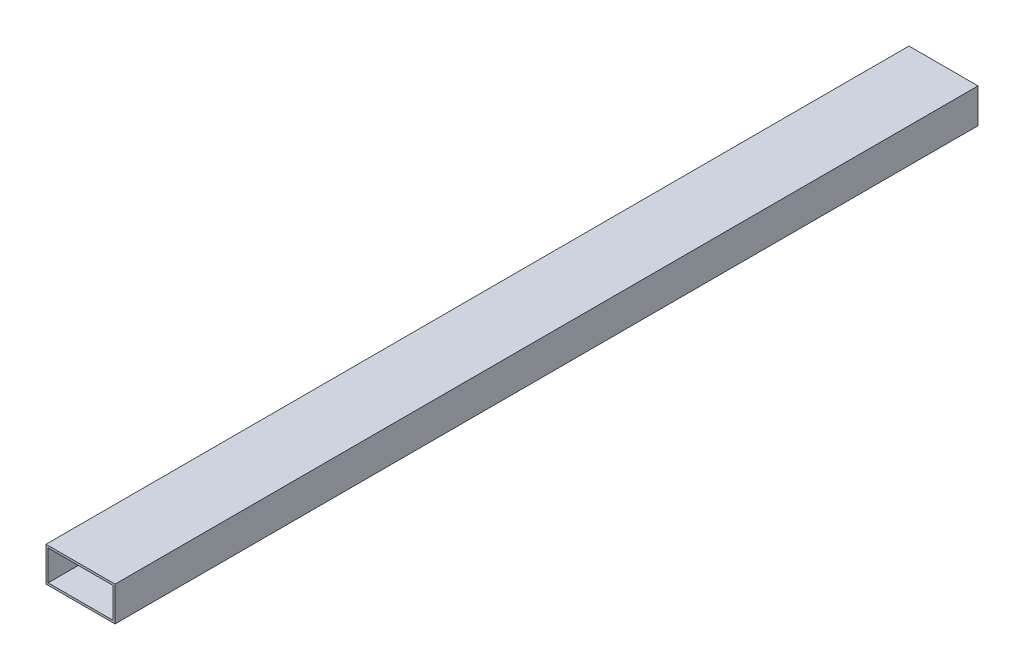
from build123d import *

# Parameters (mm, degrees)
BOSS_EXTRUDE1_DEPTH      = 317.499999
BOSS_EXTRUDE1_DEPTH_BACK = 317.499999
SKETCH3_W                = 50.8
SKETCH3_H                = 25.4
SKETCH3_W_2              = 47.625
SKETCH3_H_2              = 22.225


with BuildPart() as part:
    # Sketch3 → Boss-Extrude1 (new, two sides: drawn at the far end of the back side and taken through both)
    with BuildSketch(Plane.XY.offset(-BOSS_EXTRUDE1_DEPTH_BACK)):
        Rectangle(SKETCH3_W, SKETCH3_H)
        Rectangle(SKETCH3_W_2, SKETCH3_H_2, mode=Mode.SUBTRACT)
    extrude(amount=BOSS_EXTRUDE1_DEPTH + BOSS_EXTRUDE1_DEPTH_BACK)


solid = part.part
